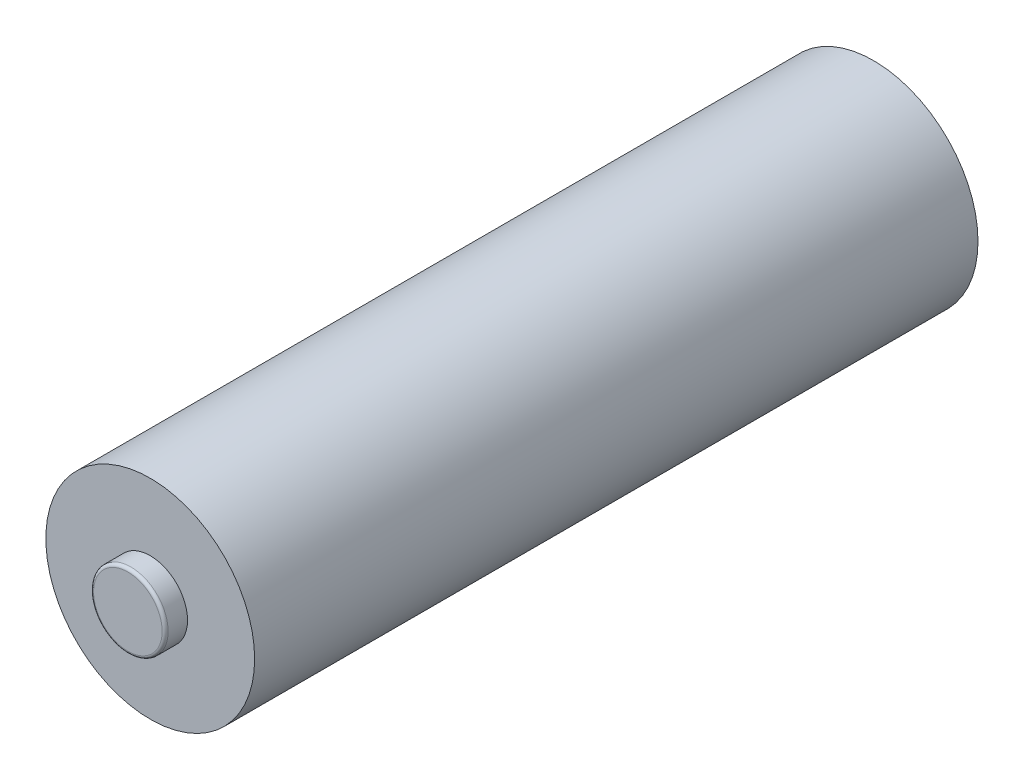
from build123d import *

# Parameters (mm, degrees)
SKETCH1_R           = 7
BOSS_EXTRUDE1_DEPTH = 50
CUT_EXTRUDE1_START  = -1.5
SKETCH2_R           = 7
SKETCH2_R_2         = 2.5
CUT_EXTRUDE1_DEPTH  = 1.5
FILLET1_R           = 0.2


with BuildPart() as part:
    # Sketch1 → Boss-Extrude1 (new body)
    with BuildSketch(Plane.XY):
        Circle(SKETCH1_R)
    extrude(amount=BOSS_EXTRUDE1_DEPTH)

    # Sketch2 → Cut-Extrude1 (cut)
    with BuildSketch(Plane.XY.offset(50).offset(CUT_EXTRUDE1_START)):
        Circle(SKETCH2_R)
        Circle(SKETCH2_R_2, mode=Mode.SUBTRACT)
    extrude(amount=CUT_EXTRUDE1_DEPTH, mode=Mode.SUBTRACT)

    # Fillet1
    fillet1_edges = [part.edges().sort_by_distance(p)[0] for p in [
        (-2.5, 0, 50),
    ]]
    fillet(fillet1_edges, radius=FILLET1_R)


solid = part.part
